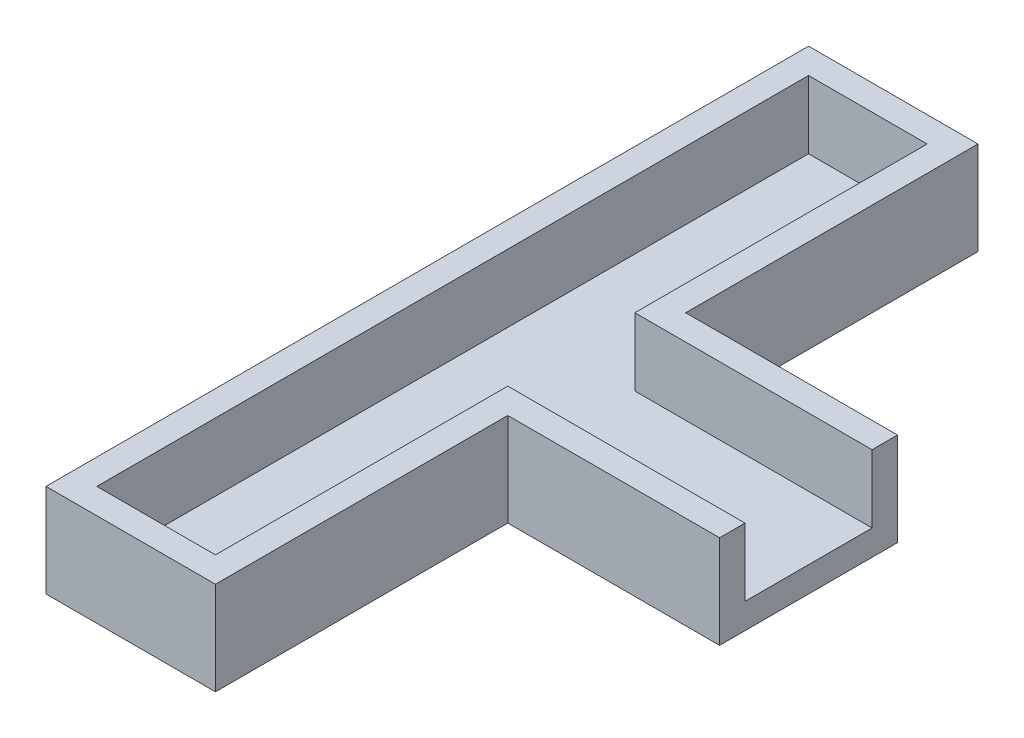
from build123d import *

# Parameters (mm, degrees)
SKETCH1_W           = 16
SKETCH1_H           = 72
BOSS_EXTRUDE1_DEPTH = 2.4
SKETCH2_W           = 16
SKETCH2_H           = 72
SKETCH2_W_2         = 11.2
SKETCH2_H_2         = 67.2
BOSS_EXTRUDE2_DEPTH = 6.4
SKETCH3_W           = 12
SKETCH3_H           = 6.4
CUT_EXTRUDE1_DEPTH  = 4.8
BOSS_EXTRUDE3_DEPTH = 20


with BuildPart() as part:
    # Sketch1 → Boss-Extrude1 (new body)
    with BuildSketch(Plane(origin=(0, 0, 0), x_dir=(1, 0, 0), z_dir=(0, 1, 0))):
        with Locations((8, 36)):
            Rectangle(SKETCH1_W, SKETCH1_H)
    extrude(amount=BOSS_EXTRUDE1_DEPTH)

    # Sketch2 → Boss-Extrude2 (add)
    with BuildSketch(Plane(origin=(0, 2.4, 0), x_dir=(1, 0, 0), z_dir=(0, 1, 0))):
        with Locations((8, 36)):
            Rectangle(SKETCH2_W, SKETCH2_H)
        with Locations((8, 36)):
            Rectangle(SKETCH2_W_2, SKETCH2_H_2, mode=Mode.SUBTRACT)
    extrude(amount=BOSS_EXTRUDE2_DEPTH)

    # Sketch3 → Cut-Extrude1 (cut)
    with BuildSketch(Plane(origin=(16, 0, 0), x_dir=(0, 0, -1), z_dir=(1, 0, 0))):
        with Locations((36, 5.6)):
            Rectangle(SKETCH3_W, SKETCH3_H)
    extrude(amount=-CUT_EXTRUDE1_DEPTH, mode=Mode.SUBTRACT)

    # Sketch4 → Boss-Extrude3 (add)
    with BuildSketch(Plane(origin=(16, 0, 0), x_dir=(0, 0, -1), z_dir=(1, 0, 0))):
        Polygon((30, 2.4), (30, 8.8), (27.6, 8.8), (27.6, 0), (44.4, 0), (44.4, 8.8), (42, 8.8), (42, 2.4), align=None)
    extrude(amount=BOSS_EXTRUDE3_DEPTH)


solid = part.part
